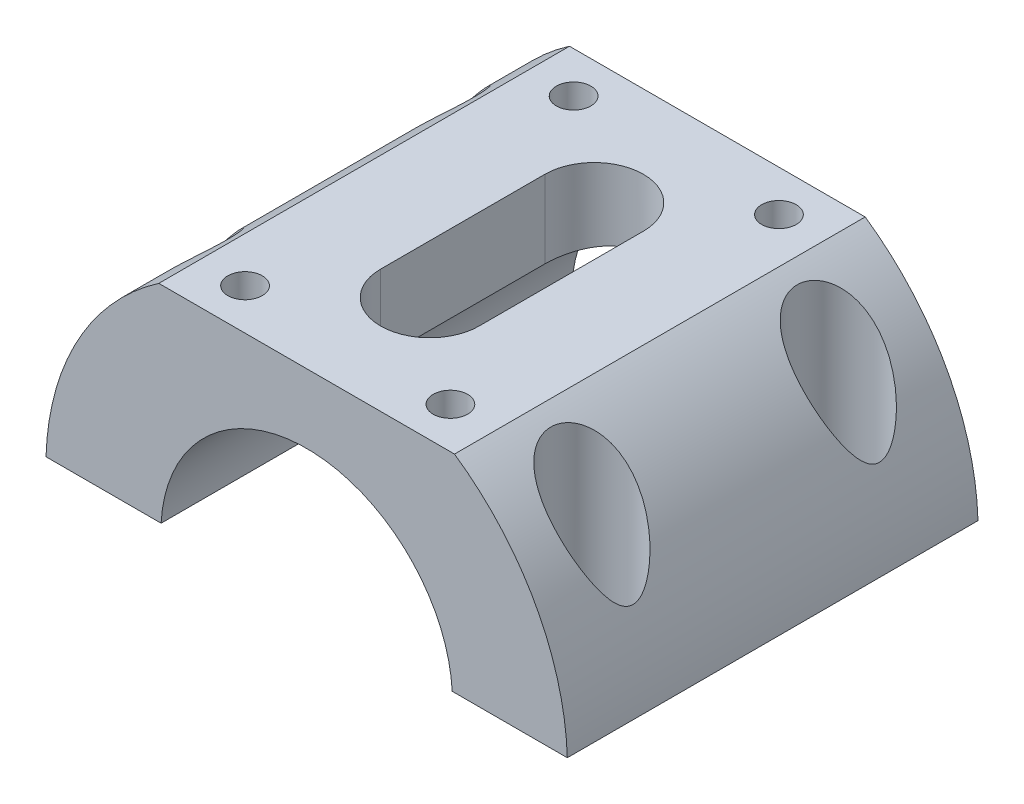
from build123d import *

# Parameters (mm, degrees)
BOSS_EXTRUDE1_DEPTH             = 50
F_5_0MM_CLEARANCE_DOWEL_HOLE1_D = 5
CUT_EXTRUDE1_REACH              = 67.4
CUT_EXTRUDE1_END_RADIUS         = 31.75
SKETCH4_R                       = 5
CUT_EXTRUDE2_REACH              = 68.728
CUT_EXTRUDE2_END_RADIUS         = 31.75
CUT_EXTRUDE3_DEPTH              = 68.19468002
TAP_DRILL_FOR_M5X0_8_TAP1_D     = 4.2
TAP_DRILL_FOR_M5X0_8_TAP1_DEPTH = 8
TAP_DRILL_FOR_M5X0_8_TAP1_TIP   = 1.2618073


with BuildPart() as part:
    # Sketch1 → Boss-Extrude1 (new body)
    with BuildSketch(Plane.XY):
        with BuildLine():
            Line((-31.734248061, 1), (-17.721808598, 1))
            ThreePointArc((-17.721808598, 1), (0, 17.75), (17.721808598, 1))
            Line((17.721808598, 1), (31.734248061, 1))
            ThreePointArc((31.734248061, 1), (0, 31.75), (-31.734248061, 1))
        make_face()
    extrude(amount=BOSS_EXTRUDE1_DEPTH)

    # Ø5.0mm Clearance Dowel Hole1 (through all)
    with Locations(Plane(origin=(-24.72802833, 1, 40), x_dir=(0, 0, -1), z_dir=(0, -1, 0))):
        with Locations((0, 0), (30, 0), (0, 49.45605666), (30, 49.45605666)):
            Hole(F_5_0MM_CLEARANCE_DOWEL_HOLE1_D / 2)

    # Cut-Extrude1: up to this cylinder (the profile starts inside it)
    cut_extrude1_end = Plane(origin=(0, 0, 25), z_dir=(0, 0, -1)) * Cylinder(CUT_EXTRUDE1_END_RADIUS, 229.3, mode=Mode.PRIVATE)
    # Sketch4 → Cut-Extrude1 (cut, up to the surface)
    with BuildSketch(Plane(origin=(0, 4, 0), x_dir=(-1, 0, 0), z_dir=(0, -1, 0)), mode=Mode.PRIVATE) as cut_extrude1_sk1:
        with Locations(Location((24.72802833, -40, 0), (0, 0, 90))):
            Circle(SKETCH4_R)
    cut_extrude1_tool1 = extrude(cut_extrude1_sk1.sketch, amount=-CUT_EXTRUDE1_REACH, mode=Mode.PRIVATE) & cut_extrude1_end
    add(cut_extrude1_tool1.solids().sort_by_distance((-24.728028, 4, 40))[0], mode=Mode.SUBTRACT)
    # Sketch4 → Cut-Extrude1 (cut, up to the surface)
    with BuildSketch(Plane(origin=(0, 4, 0), x_dir=(-1, 0, 0), z_dir=(0, -1, 0)), mode=Mode.PRIVATE) as cut_extrude1_sk2:
        with Locations(Location((24.72802833, -10, 0), (0, 0, 90))):
            Circle(SKETCH4_R)
    cut_extrude1_tool2 = extrude(cut_extrude1_sk2.sketch, amount=-CUT_EXTRUDE1_REACH, mode=Mode.PRIVATE) & cut_extrude1_end
    add(cut_extrude1_tool2.solids().sort_by_distance((-24.728028, 4, 10))[0], mode=Mode.SUBTRACT)
    # Sketch4 → Cut-Extrude1 (cut, up to the surface)
    with BuildSketch(Plane(origin=(0, 4, 0), x_dir=(-1, 0, 0), z_dir=(0, -1, 0)), mode=Mode.PRIVATE) as cut_extrude1_sk3:
        with Locations(Location((-24.72802833, -10, 0), (0, 0, 90))):
            Circle(SKETCH4_R)
    cut_extrude1_tool3 = extrude(cut_extrude1_sk3.sketch, amount=-CUT_EXTRUDE1_REACH, mode=Mode.PRIVATE) & cut_extrude1_end
    add(cut_extrude1_tool3.solids().sort_by_distance((24.728028, 4, 10))[0], mode=Mode.SUBTRACT)
    # Sketch4 → Cut-Extrude1 (cut, up to the surface)
    with BuildSketch(Plane(origin=(0, 4, 0), x_dir=(-1, 0, 0), z_dir=(0, -1, 0)), mode=Mode.PRIVATE) as cut_extrude1_sk4:
        with Locations(Location((-24.72802833, -40, 0), (0, 0, 90))):
            Circle(SKETCH4_R)
    cut_extrude1_tool4 = extrude(cut_extrude1_sk4.sketch, amount=-CUT_EXTRUDE1_REACH, mode=Mode.PRIVATE) & cut_extrude1_end
    add(cut_extrude1_tool4.solids().sort_by_distance((24.728028, 4, 40))[0], mode=Mode.SUBTRACT)

    # Cut-Extrude2: up to this cylinder (the profile starts inside it)
    cut_extrude2_end = Plane(origin=(0, 0, 25), z_dir=(0, 0, -1)) * Cylinder(CUT_EXTRUDE2_END_RADIUS, 201.956, mode=Mode.PRIVATE)
    # Sketch5 → Cut-Extrude2 (cut, up to the surface)
    with BuildSketch(Plane(origin=(0, 1, 0), x_dir=(-1, 0, 0), z_dir=(0, -1, 0)), mode=Mode.PRIVATE) as cut_extrude2_sk1:
        with BuildLine():
            Line((-6, -35), (-6, -15))
            ThreePointArc((-6, -15), (0, -9), (6, -15))
            Line((6, -15), (6, -35))
            ThreePointArc((6, -35), (0, -41), (-6, -35))
        make_face()
    cut_extrude2_tool1 = extrude(cut_extrude2_sk1.sketch, amount=-CUT_EXTRUDE2_REACH, mode=Mode.PRIVATE) & cut_extrude2_end
    add(cut_extrude2_tool1.solids().sort_by_distance((0, 1, 25))[0], mode=Mode.SUBTRACT)

    # Sketch6 → Cut-Extrude3 (cut, through all)
    with BuildSketch(Plane.XY.offset(50)):
        with BuildLine():
            Line((18, 26.154588508), (-18, 26.154588508))
            ThreePointArc((-18, 26.154588508), (0, 31.75), (18, 26.154588508))
        make_face()
    extrude(amount=-CUT_EXTRUDE3_DEPTH, mode=Mode.SUBTRACT)

    # Tap Drill for M5x0.8 Tap1
    with Locations(Plane(origin=(-12.5, 26.154588508, 5), x_dir=(0, 0, 1), z_dir=(0, 1, 0))):
        with Locations((0, 0), (40, 0), (40, 25), (0, 25)):
            Hole(TAP_DRILL_FOR_M5X0_8_TAP1_D / 2, depth=TAP_DRILL_FOR_M5X0_8_TAP1_DEPTH)
            with Locations((0, 0, -(TAP_DRILL_FOR_M5X0_8_TAP1_DEPTH + TAP_DRILL_FOR_M5X0_8_TAP1_TIP / 2))):  # 118° drill point
                Cone(0, TAP_DRILL_FOR_M5X0_8_TAP1_D / 2, TAP_DRILL_FOR_M5X0_8_TAP1_TIP, mode=Mode.SUBTRACT)


solid = part.part
